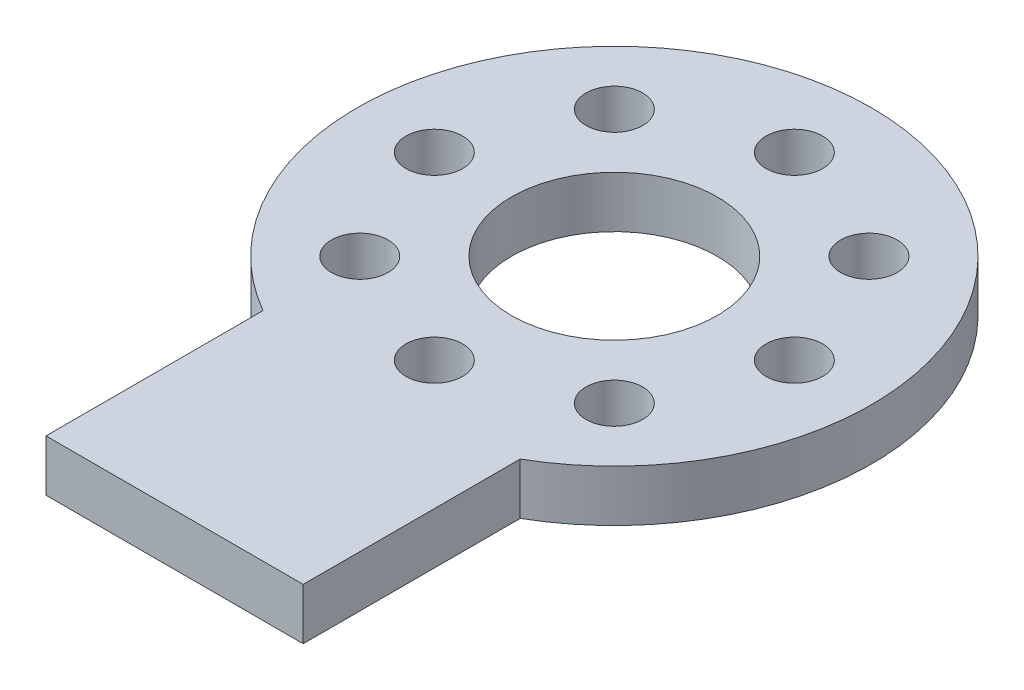
from build123d import *

# Parameters (mm, degrees)
BOSS_EXTRUDE1_DEPTH  = 5
M5_CLEARANCE_HOLE1_D = 5.5
SKETCH6_R            = 10
CUT_EXTRUDE1_DEPTH   = 50.773304207


with BuildPart() as part:
    # Sketch1 → Boss-Extrude1 (new body)
    with BuildSketch(Plane(origin=(0, 0, 0), x_dir=(1, 0, 0), z_dir=(0, 1, 0))):
        with BuildLine():
            Line((-12.5, -42.747886634), (12.5, -42.747886634))
            Line((12.5, -42.747886634), (12.5, -21.650635095))
            ThreePointArc((12.5, -21.650635095), (0, 25), (-12.5, -21.650635095))
            Line((-12.5, -21.650635095), (-12.5, -42.747886634))
        make_face()
    extrude(amount=BOSS_EXTRUDE1_DEPTH)

    # M5 Clearance Hole1 (through all)
    with Locations(Plane(origin=(0, 5, 0), x_dir=(1, 0, 0), z_dir=(0, 1, 0))):
        with Locations((-12.374368671, 12.374368671), (0, 17.5), (12.374368671, 12.374368671), (17.5, 0), (12.374368671, -12.374368671), (0, -17.5), (-12.374368671, -12.374368671), (-17.5, 0)):
            Hole(M5_CLEARANCE_HOLE1_D / 2)

    # Sketch6 → Cut-Extrude1 (cut, through all)
    with BuildSketch(Plane(origin=(0, 5, 0), x_dir=(1, 0, 0), z_dir=(0, 1, 0))):
        with Locations(Location((0, 0, 0), (0, 0, 270))):
            Circle(SKETCH6_R)
    extrude(amount=-CUT_EXTRUDE1_DEPTH, mode=Mode.SUBTRACT)


solid = part.part
